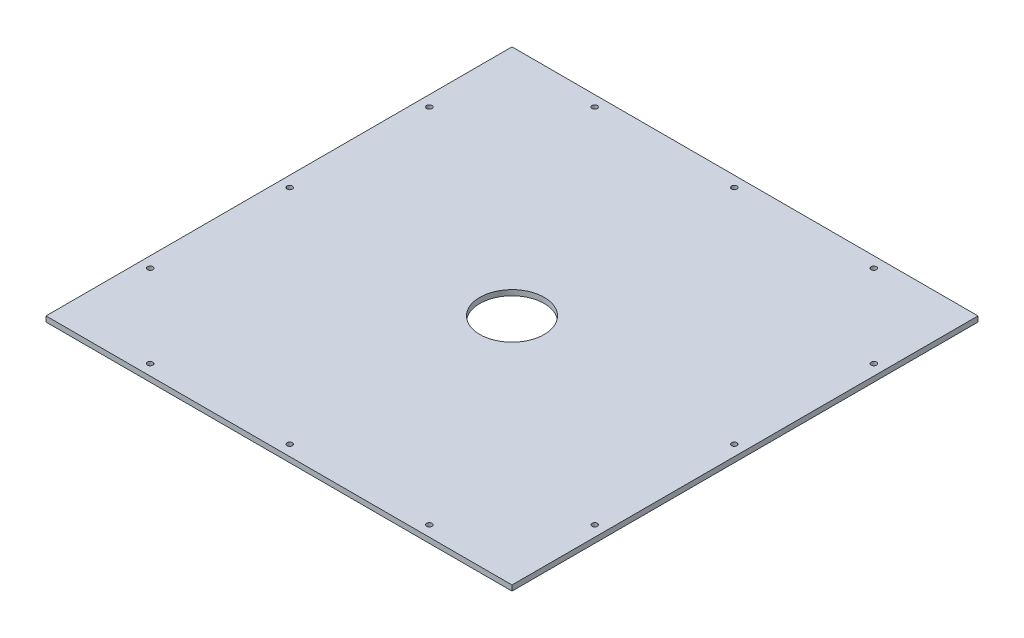
from build123d import *

# Parameters (mm, degrees)
SKETCH1_W           = 434
SKETCH1_H           = 434
BOSS_EXTRUDE1_DEPTH = 5
SKETCH2_R           = 2.5
CUT_EXTRUDE1_DEPTH  = 5
SKETCH3_R           = 30
CUT_EXTRUDE2_DEPTH  = 5


with BuildPart() as part:
    # Sketch1 → Boss-Extrude1 (new body)
    with BuildSketch(Plane(origin=(0, 0, 0), x_dir=(1, 0, 0), z_dir=(0, 1, 0))):
        Rectangle(SKETCH1_W, SKETCH1_H)
    extrude(amount=BOSS_EXTRUDE1_DEPTH)

    # Sketch2 → Cut-Extrude1 (cut)
    with BuildSketch(Plane(origin=(0, 5, 0), x_dir=(1, 0, 0), z_dir=(0, 1, 0))):
        with Locations(Location((-207, 130, 0), (0, 0, 270))):
            Circle(SKETCH2_R)
        with Locations(Location((-207, 0, 0), (0, 0, 270))):
            Circle(SKETCH2_R)
        with Locations(Location((-207, -130, 0), (0, 0, 90))):
            Circle(SKETCH2_R)
        with Locations(Location((207, -130, 0), (0, 0, 270))):
            Circle(SKETCH2_R)
        with Locations(Location((207, 0, 0), (0, 0, 90))):
            Circle(SKETCH2_R)
        with Locations(Location((207, 130, 0), (0, 0, 90))):
            Circle(SKETCH2_R)
        with Locations(Location((130, 207, 0), (0, 0, 270))):
            Circle(SKETCH2_R)
        with Locations(Location((0, 207, 0), (0, 0, 270))):
            Circle(SKETCH2_R)
        with Locations(Location((-130, 207, 0), (0, 0, 90))):
            Circle(SKETCH2_R)
        with Locations(Location((-130, -207, 0), (0, 0, 270))):
            Circle(SKETCH2_R)
        with Locations(Location((0, -207, 0), (0, 0, 90))):
            Circle(SKETCH2_R)
        with Locations(Location((130, -207, 0), (0, 0, 90))):
            Circle(SKETCH2_R)
    extrude(amount=-CUT_EXTRUDE1_DEPTH, mode=Mode.SUBTRACT)

    # Sketch3 → Cut-Extrude2 (cut)
    with BuildSketch(Plane(origin=(0, 5, 0), x_dir=(1, 0, 0), z_dir=(0, 1, 0))):
        with Locations(Location((0, 0, 0), (0, 0, 270))):
            Circle(SKETCH3_R)
    extrude(amount=-CUT_EXTRUDE2_DEPTH, mode=Mode.SUBTRACT)


solid = part.part
